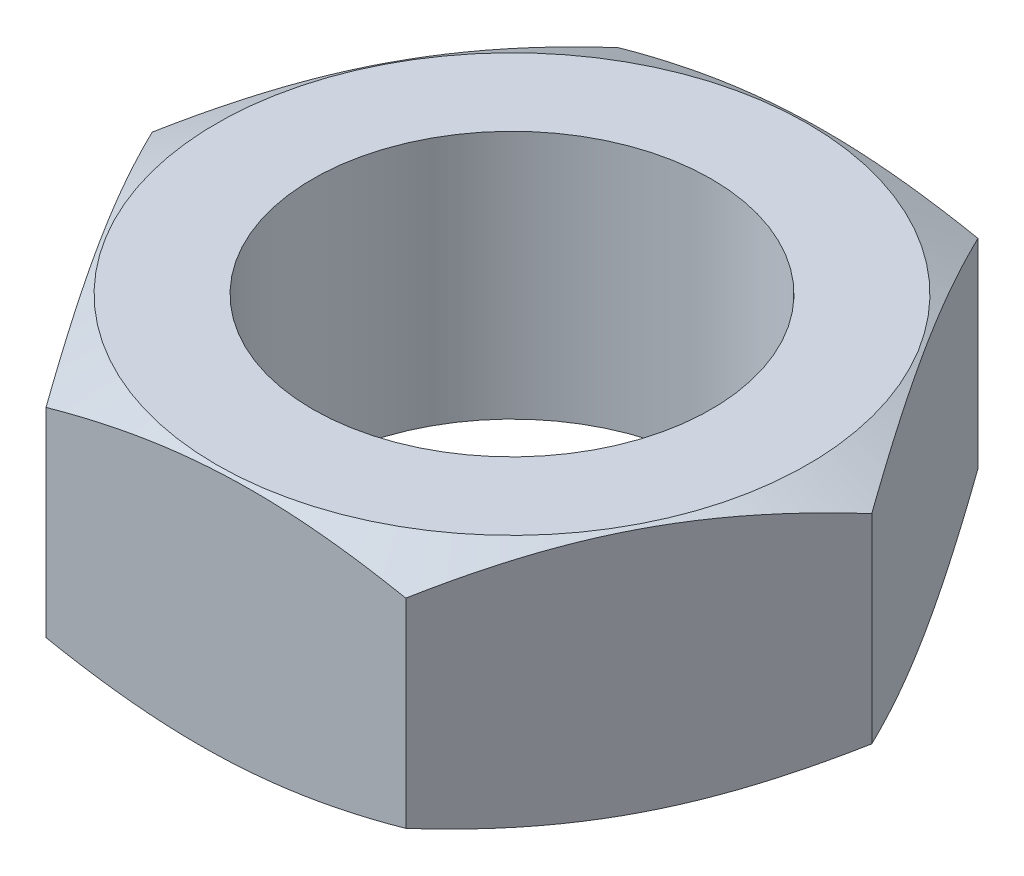
from build123d import *

# Parameters (mm, degrees)
SKETCH_1_R      = 4
EXTRUDE_1_DEPTH = 5


with BuildPart() as part:
    # 草图1 → 凸台-拉伸1 (new body)
    with BuildSketch(Plane(origin=(0, 0, 0), x_dir=(1, 0, 0), z_dir=(0, 1, 0))):
        Polygon((3.205904539, 6.141838169), (-3.716035611, 5.847313857), (-6.921940149, -0.294524312), (-3.205904539, -6.141838169), (3.716035611, -5.847313857), (6.921940149, 0.294524312), align=None)
        with Locations(Location((0, 0, 0), (0, 0, 270))):
            Circle(SKETCH_1_R, mode=Mode.SUBTRACT)
    extrude(amount=EXTRUDE_1_DEPTH)

    # 草图2 → 切除-旋转1 (revolve, cut)
    with BuildSketch(Plane(origin=(0, 0, 0), x_dir=(0.4627324620846592, 0, -0.8864979799937897), z_dir=(0.8864979799937897, 0, 0.4627324620846592)), mode=Mode.PRIVATE) as cut_revolve_1_sk:
        Polygon((-6.92820323, 4.5), (-6.92820323, 5), (-5.92820323, 5), align=None)
        Polygon((-6.92820323, 0.5), (-6.92820323, 0), (-5.92820323, 0), align=None)
    revolve(cut_revolve_1_sk.sketch.rotate(Axis((0, 0, 0), (0, 1, 0)), 207.563569327), axis=Axis((0, 0, 0), (0, 1, 0)), mode=Mode.SUBTRACT)


solid = part.part
